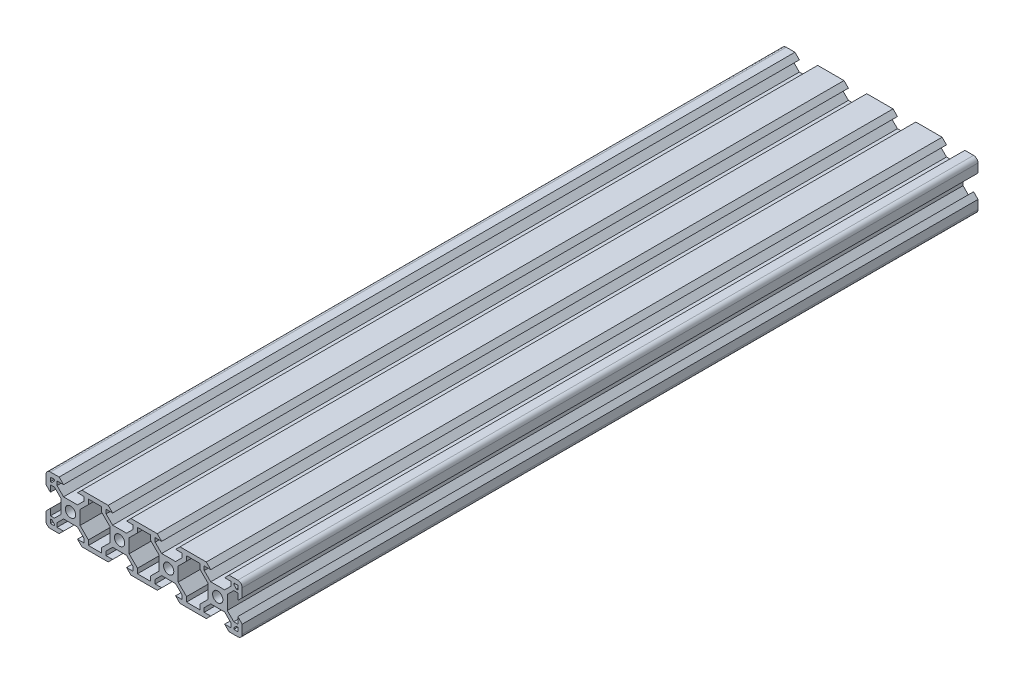
from build123d import *

# Parameters (mm, degrees)
ESQUISSE1_R        = 2.1
BOSS_EXTRU_1_DEPTH = 150


with BuildPart() as part:
    # Esquisse1 → Boss.-Extru.1 (new, symmetric)
    with BuildSketch(Plane.XY):
        with BuildLine():
            Line((-38.199999929, 10), (-34.639999675, 10))
            Line((-34.639999675, 10), (-32.839999603, 8.2))
            Line((-32.839999603, 8.2), (-35.499339671, 8.2))
            Line((-35.499339671, 8.2), (-35.499339671, 6.56))
            Line((-35.499339671, 6.56), (-32.839999603, 3.900660038))
            Line((-32.839999603, 3.900660038), (-27.159999603, 3.900660038))
            Line((-27.159999603, 3.900660038), (-24.500659536, 6.56))
            Line((-24.500659536, 6.56), (-24.500659536, 8.2))
            Line((-24.500659536, 8.2), (-27.159999603, 8.2))
            Line((-27.159999603, 8.2), (-25.359999532, 10))
            Line((-25.359999532, 10), (-14.640000468, 10))
            Line((-14.640000468, 10), (-12.840000397, 8.2))
            Line((-12.840000397, 8.2), (-15.499340464, 8.2))
            Line((-15.499340464, 8.2), (-15.499340464, 6.56))
            Line((-15.499340464, 6.56), (-12.840000397, 3.900660038))
            Line((-12.840000397, 3.900660038), (-7.159998809, 3.900660038))
            Line((-7.159998809, 3.900660038), (-4.500658742, 6.56))
            Line((-4.500658742, 6.56), (-4.500658742, 8.2))
            Line((-4.500658742, 8.2), (-7.159998809, 8.2))
            Line((-7.159998809, 8.2), (-5.359998738, 10))
            Line((-5.359998738, 10), (5.359998738, 10))
            Line((5.359998738, 10), (7.159998809, 8.2))
            Line((7.159998809, 8.2), (4.500658742, 8.2))
            Line((4.500658742, 8.2), (4.500658742, 6.56))
            Line((4.500658742, 6.56), (7.159998809, 3.900660038))
            Line((7.159998809, 3.900660038), (12.840000397, 3.900660038))
            Line((12.840000397, 3.900660038), (15.499340464, 6.56))
            Line((15.499340464, 6.56), (15.499340464, 8.2))
            Line((15.499340464, 8.2), (12.840000397, 8.2))
            Line((12.840000397, 8.2), (14.640000468, 10))
            Line((14.640000468, 10), (25.359999532, 10))
            Line((25.359999532, 10), (27.159999603, 8.2))
            Line((27.159999603, 8.2), (24.500659536, 8.2))
            Line((24.500659536, 8.2), (24.500659536, 6.56))
            Line((24.500659536, 6.56), (27.159999603, 3.900660038))
            Line((27.159999603, 3.900660038), (32.839999603, 3.900660038))
            Line((32.839999603, 3.900660038), (35.499339671, 6.56))
            Line((35.499339671, 6.56), (35.499339671, 8.2))
            Line((35.499339671, 8.2), (32.839999603, 8.2))
            Line((32.839999603, 8.2), (34.639999675, 10))
            Line((34.639999675, 10), (38.199999929, 10))
            ThreePointArc((38.199999929, 10), (39.47279216, 9.472792181), (39.999999929, 8.199999929))
            Line((39.999999929, 8.199999929), (39.999999787, 4.639999675))
            Line((39.999999787, 4.639999675), (38.199999716, 2.839999675))
            Line((38.199999716, 2.839999675), (38.199999821, 5.499339742))
            Line((38.199999821, 5.499339742), (36.559999821, 5.499339807))
            Line((36.559999821, 5.499339807), (33.900659754, 2.839999845))
            Line((33.900659754, 2.839999845), (33.900659641, 0))
            Line((33.900659641, 0), (33.900659754, -2.839999845))
            Line((33.900659754, -2.839999845), (36.559999821, -5.499339807))
            Line((36.559999821, -5.499339807), (38.199999821, -5.499339742))
            Line((38.199999821, -5.499339742), (38.199999716, -2.839999675))
            Line((38.199999716, -2.839999675), (39.999999787, -4.639999675))
            Line((39.999999787, -4.639999675), (39.999999929, -8.199999929))
            ThreePointArc((39.999999929, -8.199999929), (39.47279216, -9.472792181), (38.199999929, -10))
            Line((38.199999929, -10), (34.639999675, -10))
            Line((34.639999675, -10), (32.839999603, -8.2))
            Line((32.839999603, -8.2), (35.499339671, -8.2))
            Line((35.499339671, -8.2), (35.499339671, -6.56))
            Line((35.499339671, -6.56), (32.839999603, -3.900660038))
            Line((32.839999603, -3.900660038), (27.159999603, -3.900660038))
            Line((27.159999603, -3.900660038), (24.500659536, -6.56))
            Line((24.500659536, -6.56), (24.500659536, -8.2))
            Line((24.500659536, -8.2), (27.159999603, -8.2))
            Line((27.159999603, -8.2), (25.359999532, -10))
            Line((25.359999532, -10), (14.640000468, -10))
            Line((14.640000468, -10), (12.840000397, -8.2))
            Line((12.840000397, -8.2), (15.499340464, -8.2))
            Line((15.499340464, -8.2), (15.499340464, -6.56))
            Line((15.499340464, -6.56), (12.840000397, -3.900660038))
            Line((12.840000397, -3.900660038), (7.159998809, -3.900660038))
            Line((7.159998809, -3.900660038), (4.500658742, -6.56))
            Line((4.500658742, -6.56), (4.500658742, -8.2))
            Line((4.500658742, -8.2), (7.159998809, -8.2))
            Line((7.159998809, -8.2), (5.359998738, -10))
            Line((5.359998738, -10), (-5.359998738, -10))
            Line((-5.359998738, -10), (-7.159998809, -8.2))
            Line((-7.159998809, -8.2), (-4.500658742, -8.2))
            Line((-4.500658742, -8.2), (-4.500658742, -6.56))
            Line((-4.500658742, -6.56), (-7.159998809, -3.900660038))
            Line((-7.159998809, -3.900660038), (-12.840000397, -3.900660038))
            Line((-12.840000397, -3.900660038), (-15.499340464, -6.56))
            Line((-15.499340464, -6.56), (-15.499340464, -8.2))
            Line((-15.499340464, -8.2), (-12.840000397, -8.2))
            Line((-12.840000397, -8.2), (-14.640000468, -10))
            Line((-14.640000468, -10), (-25.359999532, -10))
            Line((-25.359999532, -10), (-27.159999603, -8.2))
            Line((-27.159999603, -8.2), (-24.500659536, -8.2))
            Line((-24.500659536, -8.2), (-24.500659536, -6.56))
            Line((-24.500659536, -6.56), (-27.159999603, -3.900660038))
            Line((-27.159999603, -3.900660038), (-32.839999603, -3.900660038))
            Line((-32.839999603, -3.900660038), (-35.499339671, -6.56))
            Line((-35.499339671, -6.56), (-35.499339671, -8.2))
            Line((-35.499339671, -8.2), (-32.839999603, -8.2))
            Line((-32.839999603, -8.2), (-34.639999675, -10))
            Line((-34.639999675, -10), (-38.199999929, -10))
            ThreePointArc((-38.199999929, -10), (-39.47279216, -9.472792181), (-39.999999929, -8.199999929))
            Line((-39.999999929, -8.199999929), (-39.999999787, -4.639999675))
            Line((-39.999999787, -4.639999675), (-38.199999716, -2.839999675))
            Line((-38.199999716, -2.839999675), (-38.199999821, -5.499339742))
            Line((-38.199999821, -5.499339742), (-36.559999821, -5.499339807))
            Line((-36.559999821, -5.499339807), (-33.900659754, -2.839999845))
            Line((-33.900659754, -2.839999845), (-33.900659641, 0))
            Line((-33.900659641, 0), (-33.900659754, 2.839999845))
            Line((-33.900659754, 2.839999845), (-36.559999821, 5.499339807))
            Line((-36.559999821, 5.499339807), (-38.199999821, 5.499339742))
            Line((-38.199999821, 5.499339742), (-38.199999716, 2.839999675))
            Line((-38.199999716, 2.839999675), (-39.999999787, 4.639999675))
            Line((-39.999999787, 4.639999675), (-39.999999929, 8.199999929))
            ThreePointArc((-39.999999929, 8.199999929), (-39.47279216, 9.472792181), (-38.199999929, 10))
        make_face()
        with Locations((-29.999999603, 0)):
            Circle(ESQUISSE1_R, mode=Mode.SUBTRACT)
        with Locations((-9.999999603, 0)):
            Circle(ESQUISSE1_R, mode=Mode.SUBTRACT)
        with Locations(Location((29.999999603, 0, 0), (0, 0, 180))):
            Circle(ESQUISSE1_R, mode=Mode.SUBTRACT)
        with Locations(Location((9.999999603, 0, 0), (0, 0, 180))):
            Circle(ESQUISSE1_R, mode=Mode.SUBTRACT)
        Polygon((-38.199999929, 8.2), (-38.199999864, 6.569339742), (-37.629999799, 6.569339742), (-36.569339648, 7.629999935), (-36.569339648, 8.2), align=None, mode=Mode.SUBTRACT)
        Polygon((-17.3, 6.239339079), (-17.3, 8.2), (-22.7, 8.2), (-22.7, 6.239339079), (-26.099339368, 2.839999845), (-26.099339368, -2.839999845), (-22.7, -6.239339079), (-22.7, -8.2), (-17.3, -8.2), (-17.3, -6.239339079), (-13.900660632, -2.839999845), (-13.900660632, 2.839999845), align=None, mode=Mode.SUBTRACT)
        Polygon((-6.099339678, -2.840000949), (-6.099339678, 2.840000949), (-2.700001413, 6.239339079), (-2.700001413, 8.2), (2.700001413, 8.2), (2.700001413, 6.239339079), (6.099339678, 2.840000949), (6.099339678, -2.840000949), (2.700001413, -6.239339079), (2.700001413, -8.2), (-2.700001413, -8.2), (-2.700001413, -6.239339079), align=None, mode=Mode.SUBTRACT)
        Polygon((-36.569339648, -7.629999935), (-36.569339648, -8.2), (-38.199999929, -8.2), (-38.199999864, -6.569339742), (-37.629999799, -6.569339742), align=None, mode=Mode.SUBTRACT)
        Polygon((36.569339648, 8.2), (38.199999929, 8.2), (38.199999864, 6.569339742), (37.629999799, 6.569339742), (36.569339648, 7.629999935), align=None, mode=Mode.SUBTRACT)
        Polygon((36.569339648, -8.2), (38.199999929, -8.2), (38.199999864, -6.569339742), (37.629999799, -6.569339742), (36.569339648, -7.629999935), align=None, mode=Mode.SUBTRACT)
        Polygon((13.900660632, -2.839999845), (17.3, -6.239339079), (17.3, -8.2), (22.7, -8.2), (22.7, -6.239339079), (26.099339368, -2.839999845), (26.099339368, 2.839999845), (22.7, 6.239339079), (22.7, 8.2), (17.3, 8.2), (17.3, 6.239339079), (13.900660632, 2.839999845), align=None, mode=Mode.SUBTRACT)
    extrude(amount=BOSS_EXTRU_1_DEPTH, both=True)


solid = part.part
